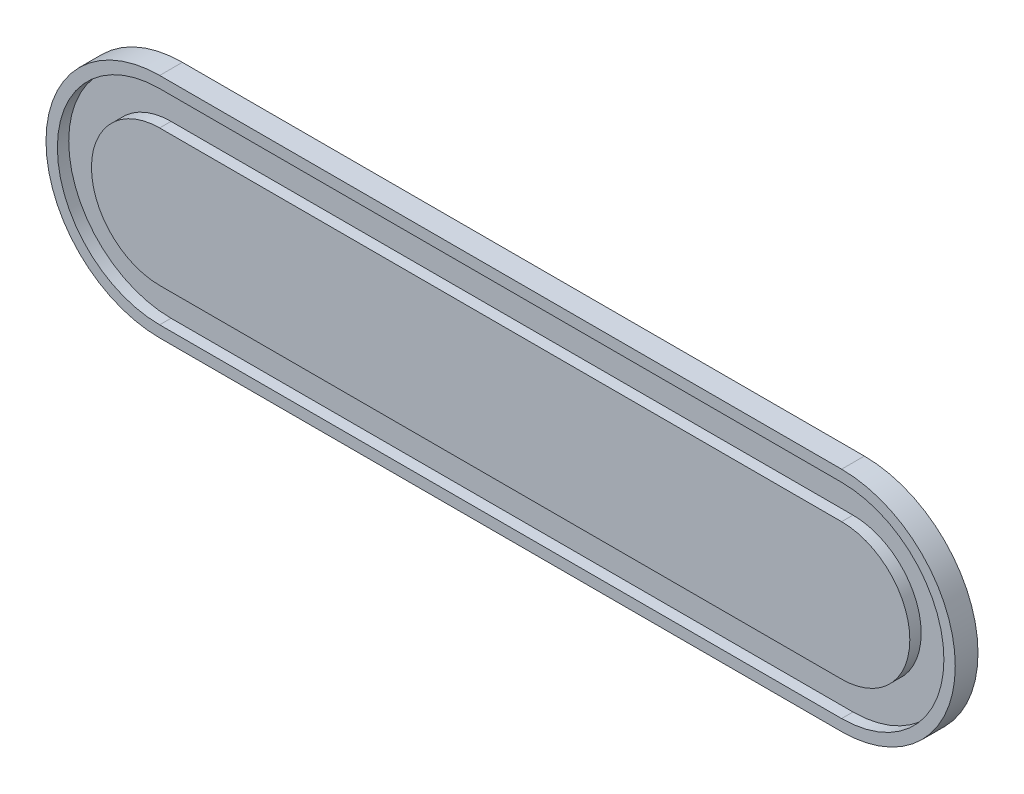
from build123d import *

# Parameters (mm, degrees)
EXTRUDE_1_DEPTH   = 1000
EXTRUDE_1_2_DEPTH = 1000
EXTRUDE_START     = -1000
EXTRUDE_2_DEPTH   = 1000


with BuildPart() as part:
    # ｽｹｯﾁ1 → ﾎﾞｽ - 押し出し1 (new body)
    with BuildSketch(Plane.XY):
        with BuildLine():
            Line((60001.566621315, 10000), (1.566621315, 10000))
            ThreePointArc((1.566621315, 10000), (-9998.433378685, 0), (1.566621315, -10000))
            Line((1.566621315, -10000), (60001.566621315, -10000))
            ThreePointArc((60001.566621315, -10000), (70001.566621315, 0), (60001.566621315, 10000))
        make_face()
        with BuildLine():
            ThreePointArc((1.566621315, -9000), (-8998.433378685, 0), (1.566621315, 9000))
            Line((1.566621315, 9000), (60001.566621315, 9000))
            ThreePointArc((60001.566621315, 9000), (69001.566621315, 0), (60001.566621315, -9000))
            Line((60001.566621315, -9000), (1.566621315, -9000))
        make_face(mode=Mode.SUBTRACT)
    extrude(amount=EXTRUDE_1_DEPTH)



with BuildPart() as body_2:
    # ｽｹｯﾁ1 → Extrude 1 2 (new body)
    with BuildSketch(Plane.XY):
        with BuildLine():
            Line((60001.566621315, 6000), (1.566621315, 6000))
            ThreePointArc((1.566621315, 6000), (-5998.433378685, 0), (1.566621315, -6000))
            Line((1.566621315, -6000), (60001.566621315, -6000))
            ThreePointArc((60001.566621315, -6000), (66001.566621315, 0), (60001.566621315, 6000))
        make_face()
    extrude(amount=EXTRUDE_1_2_DEPTH)


with BuildPart() as part_1:
    add(part.part)

    add(body_2.part)  # ﾎﾞｽ - 押し出し2 merges body 2
    # ｽｹｯﾁ1<3> → ﾎﾞｽ - 押し出し2 (add)
    with BuildSketch(Plane.XY.offset(EXTRUDE_START)):
        with BuildLine():
            Line((60001.566621315, 10000), (1.566621315, 10000))
            ThreePointArc((1.566621315, 10000), (-9998.433378685, 0), (1.566621315, -10000))
            Line((1.566621315, -10000), (60001.566621315, -10000))
            ThreePointArc((60001.566621315, -10000), (70001.566621315, 0), (60001.566621315, 10000))
        make_face()
    extrude(amount=EXTRUDE_2_DEPTH)


solid = part_1.part
